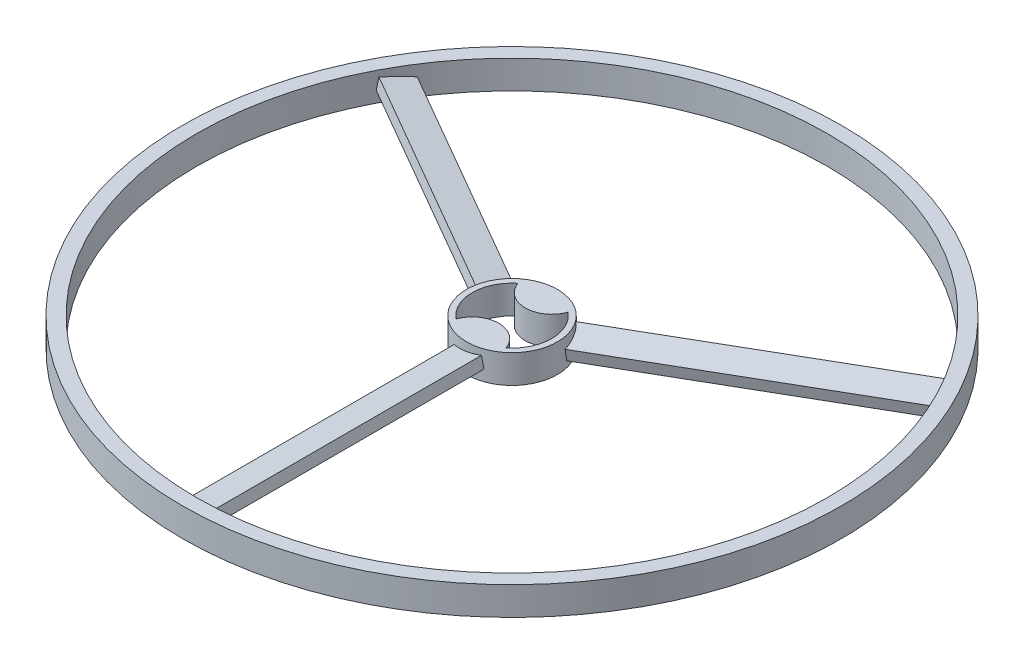
from build123d import *

# Parameters (mm, degrees)
SKETCH7_R                = 58
SKETCH7_R_2              = 55.5
BOSS_EXTRUDE4_DEPTH      = 2.5
BOSS_EXTRUDE5_REACH      = 84.062
BOSS_EXTRUDE5_END_RADIUS = 55.5
SKETCH2_R                = 8
BOSS_EXTRUDE6_DEPTH      = 2.5
CIRPATTERN5_COUNT        = 3
CUT_EXTRUDE2_DEPTH       = 10


with BuildPart() as part:
    # Sketch7 → Boss-Extrude4 (new, symmetric)
    with BuildSketch(Plane(origin=(0, 0, 0), x_dir=(1, 0, 0), z_dir=(0, 1, 0))):
        with Locations(Location((0, 0, 0), (0, 0, 270))):
            Circle(SKETCH7_R)
        with Locations(Location((0, 0, 0), (0, 0, 270))):
            Circle(SKETCH7_R_2, mode=Mode.SUBTRACT)
    extrude(amount=BOSS_EXTRUDE4_DEPTH, both=True)

    # Boss-Extrude5: up to this cylinder (the profile starts inside it)
    boss_extrude5_end = Plane(origin=(0, 0, 0), z_dir=(0, -1, 0)) * Cylinder(BOSS_EXTRUDE5_END_RADIUS, 280.124, mode=Mode.PRIVATE)
    # Sketch1 → Boss-Extrude5 (add, up to the surface)
    with BuildSketch(Plane.XY, mode=Mode.PRIVATE) as boss_extrude5_sk1:
        Polygon((2.288371205, 1.418928197), (2.63566756, -0.550687309), (-2.288371205, -1.418928197), (-2.63566756, 0.550687309), align=None)
    boss_extrude5_tool1 = extrude(boss_extrude5_sk1.sketch, amount=BOSS_EXTRUDE5_REACH, mode=Mode.PRIVATE) & boss_extrude5_end
    boss_extrude5 = boss_extrude5_tool1.solids().sort_by_distance((0, 0, 0))[0]
    add(boss_extrude5)

    # Sketch2 → Boss-Extrude6 (add, symmetric)
    with BuildSketch(Plane(origin=(0, 0, 0), x_dir=(1, 0, 0), z_dir=(0, 1, 0))):
        with Locations(Location((0, 0, 0), (0, 0, 270))):
            Circle(SKETCH2_R)
    extrude(amount=BOSS_EXTRUDE6_DEPTH, both=True)

    # CirPattern5: Boss-Extrude5 ×3 about axis
    cirpattern5_axis = Axis((0, 0, 0), (0, 1, 0))
    for i in range(1, CIRPATTERN5_COUNT):
        add(boss_extrude5.rotate(cirpattern5_axis, i * 360 / CIRPATTERN5_COUNT))

    # Sketch9 → Cut-Extrude2 (cut)
    with BuildSketch(Plane(origin=(0, 2.5, 0), x_dir=(1, 0, 0), z_dir=(0, 1, 0))):
        with BuildLine():
            ThreePointArc((-4.399803026, -5.444422222), (-7, 0), (-4.399803026, 5.444422222))
            ThreePointArc((-4.399803026, 5.444422222), (0, 2.3333), (4.399803026, 5.444422222))
            ThreePointArc((4.399803026, 5.444422222), (7, 0), (4.399803026, -5.444422222))
            ThreePointArc((4.399803026, -5.444422222), (0, -2.3333), (-4.399803026, -5.444422222))
        make_face()
    extrude(amount=-CUT_EXTRUDE2_DEPTH, mode=Mode.SUBTRACT)


solid = part.part
